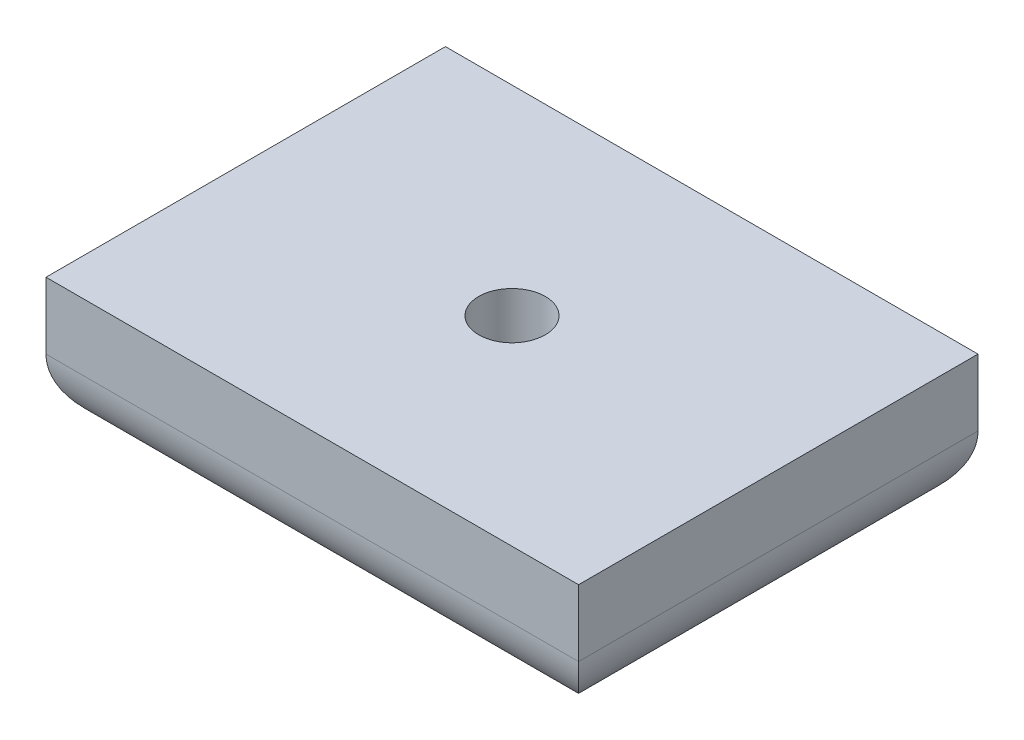
from build123d import *

# Parameters (mm, degrees)
ESQUISSE1_W     = 40
ESQUISSE1_H     = 30
ESQUISSE1_R     = 2.5
BASE_DEPTH      = 10
EXT_R           = 5
ESQUISSE2_R     = 4
ACCES_VIS_DEPTH = 5


with BuildPart() as part:
    # Esquisse1 → BASE (new body)
    with BuildSketch(Plane(origin=(0, 0, 0), x_dir=(1, 0, 0), z_dir=(0, 1, 0))):
        Rectangle(ESQUISSE1_W, ESQUISSE1_H)
        with Locations(Location((0, 0, 0), (0, 0, 270))):
            Circle(ESQUISSE1_R, mode=Mode.SUBTRACT)
    extrude(amount=BASE_DEPTH)

    # EXT
    ext_edges = [part.edges().sort_by_distance(p)[0] for p in [
        (0, 0, -15),
        (20, 0, 0),
        (0, 0, 15),
        (-20, 0, 0),
    ]]
    fillet(ext_edges, radius=EXT_R)

    # Esquisse2 → ACCES VIS (cut)
    with BuildSketch(Plane(origin=(0, 0, 0), x_dir=(-1, 0, 0), z_dir=(0, -1, 0))):
        with Locations(Location((0, 0, 0), (0, 0, 90))):
            Circle(ESQUISSE2_R)
    extrude(amount=-ACCES_VIS_DEPTH, mode=Mode.SUBTRACT)


solid = part.part
